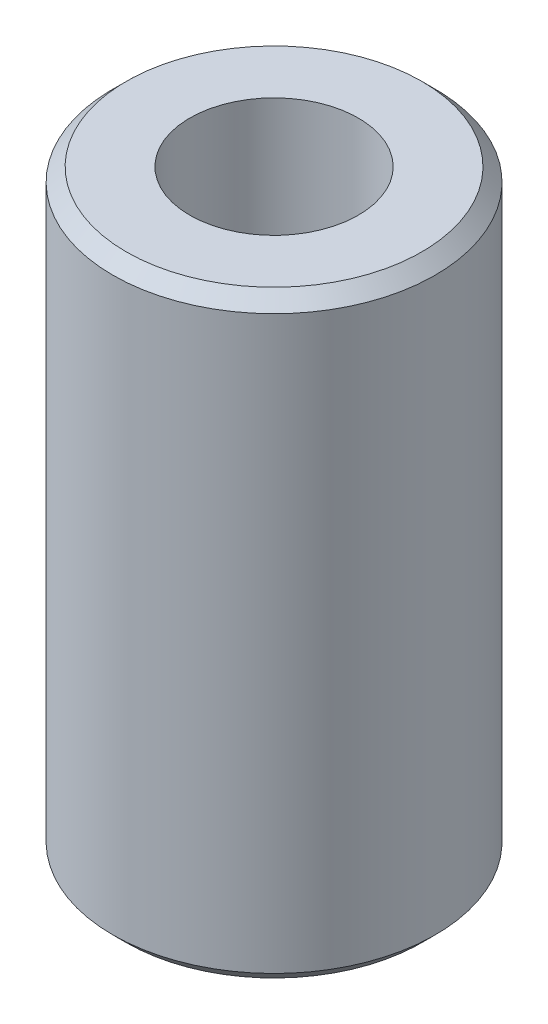
from build123d import *

# Parameters (mm, degrees)
CROQUIS2_R                = 4.7625
SALIENTE_EXTRUIR1_DEPTH   = 8.837499978
CHAFL_N1_SIZE             = 0.396875
CLEARANCE_HOLE_DEPTH      = 12.111445377
CLEARANCE_HOLE_DEPTH_BACK = 12.111445377
CROQUIS4_R                = 2.4892


with BuildPart() as part:
    # Croquis2 → Saliente-Extruir1 (new, symmetric)
    with BuildSketch(Plane(origin=(0, 0, 0), x_dir=(1, 0, 0), z_dir=(0, 1, 0))):
        Circle(CROQUIS2_R)
    extrude(amount=SALIENTE_EXTRUIR1_DEPTH, both=True)

    # Chaflán1
    chafl_n1_edges = [part.edges().sort_by_distance(p)[0] for p in [
        (-4.7625, -8.837499978, 0),
        (-4.7625, 8.837499978, 0),
    ]]
    chamfer(chafl_n1_edges, length=CHAFL_N1_SIZE)

    # Croquis4 → Clearance Hole (cut, two sides: drawn at the far end of the back side and taken through both)
    with BuildSketch(Plane(origin=(0, 0, 0), x_dir=(1, 0, 0), z_dir=(0, 1, 0)).offset(-CLEARANCE_HOLE_DEPTH_BACK)):
        Circle(CROQUIS4_R)
    extrude(amount=CLEARANCE_HOLE_DEPTH + CLEARANCE_HOLE_DEPTH_BACK, mode=Mode.SUBTRACT)


solid = part.part
